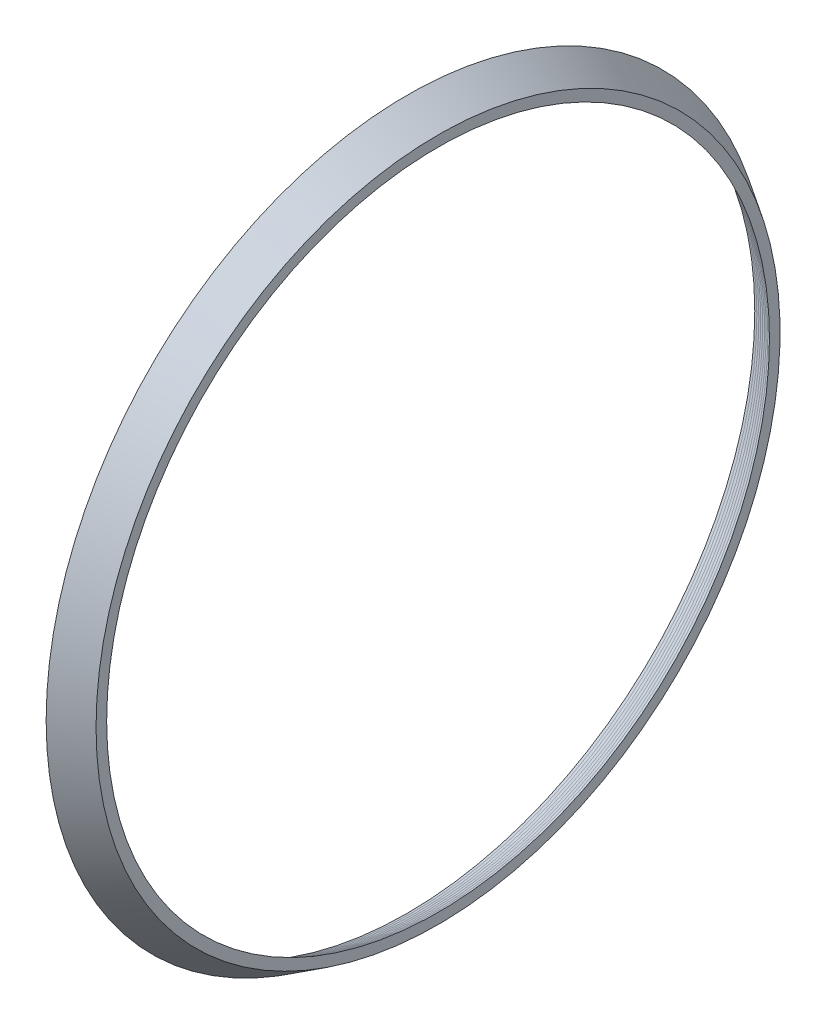
from build123d import *


with BuildPart() as part:
    # Bottle_Liner_Seat Sketch → Bottle_Liner_Seat (revolve)
    with BuildSketch(Plane.XY):
        Polygon((3.175, 68.322086283), (2.38125, 68.789822501), (1.5875, 69.241731249), (0.79375, 69.678304925), (0, 70.1), (-0.79375, 70.507240342), (-1.5875, 70.900420139), (-2.38125, 71.279906477), (-3.175, 71.646041639), (-3.175, 74.4485), (3.175, 70.5115), align=None)
    revolve(axis=Axis((-300, 0, 0), (1, 0, 0)))


solid = part.part
